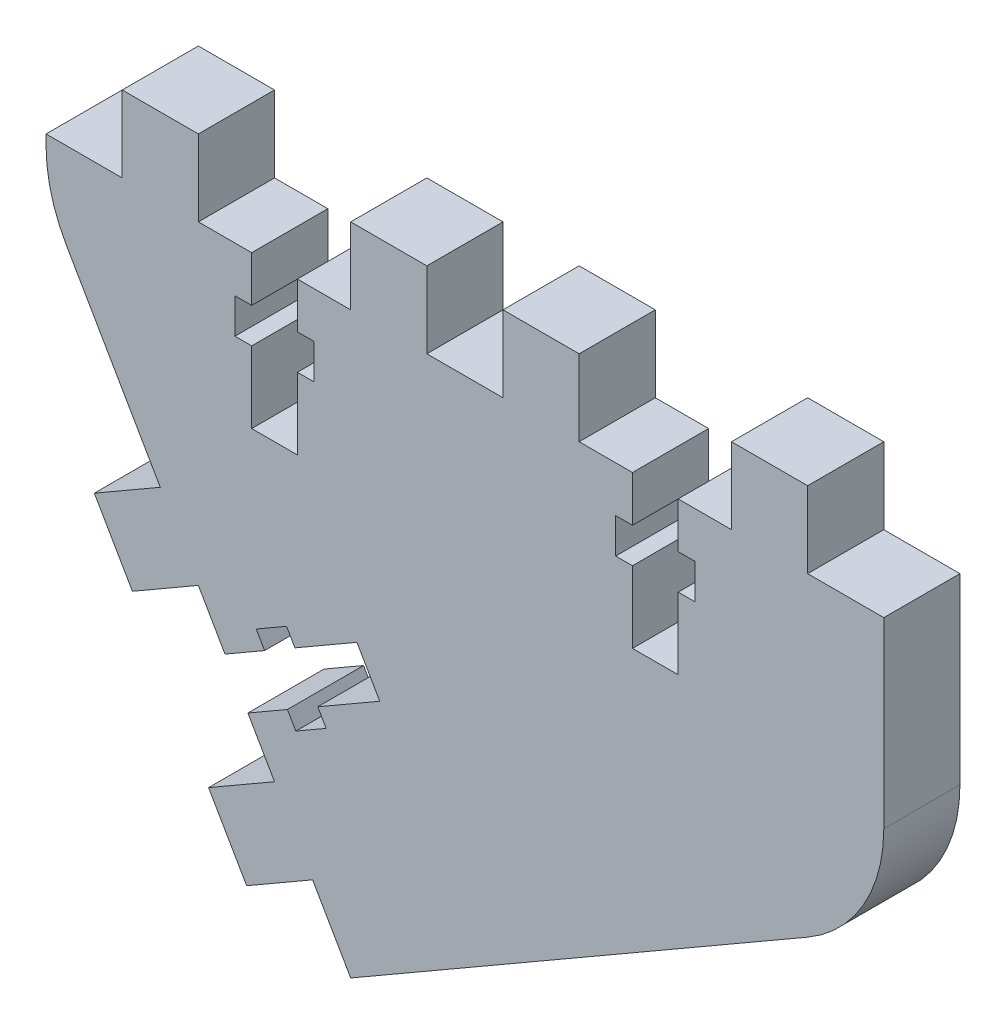
from build123d import *

# Parameters (mm, degrees)
BOSS_EXTRU_1_DEPTH = 5
CONG_1_R           = 10


with BuildPart() as part:
    # Esquisse1 → Boss.-Extru.1 (new body)
    with BuildSketch(Plane.XY):
        Polygon((-7.5, 12.990381057), (-5, 8.660254038), (-9.330127019, 6.160254038), (-6.830127019, 1.830127019), (-2.5, 4.330127019), (-0.75, 1.299038106), (1.848076211, 2.799038106), (1.298076211, 3.75166605), (3.28993464, 4.90166605), (3.83993464, 3.949038106), (7.910254038, 6.299038106), (9.410254038, 3.700961894), (5.33993464, 1.350961894), (5.88993464, 0.39833395), (3.898076211, -0.75166605), (3.348076211, 0.200961894), (0.75, -1.299038106), (2.5, -4.330127019), (-1.830127019, -6.830127019), (0.669872981, -11.160254038), (5, -8.660254038), (7.5, -12.990381057), (42.5, 7.216878365), (42.5, 25), (37.5, 25), (37.5, 30), (32.5, 30), (32.5, 25), (29, 25), (29, 22), (30.1, 22), (30.1, 19.7), (29, 19.7), (29, 15), (26, 15), (26, 19.7), (24.9, 19.7), (24.9, 22), (26, 22), (26, 25), (22.5, 25), (22.5, 30), (17.5, 30), (17.5, 25), (12.5, 25), (12.5, 30), (7.5, 30), (7.5, 25), (4, 25), (4, 22), (5.1, 22), (5.1, 19.7), (4, 19.7), (4, 15), (1, 15), (1, 19.7), (-0.1, 19.7), (-0.1, 22), (1, 22), (1, 25), (-2.5, 25), (-2.5, 30), (-7.5, 30), (-7.5, 25), (-12.5, 25), (-12.5, 21.650635095), align=None)
    extrude(amount=BOSS_EXTRU_1_DEPTH)

    # Congé1
    cong_1_edges = [part.edges().sort_by_distance(p)[0] for p in [
        (42.5, 7.216878365, 2.5),
        (-12.5, 21.650635095, 2.5),
    ]]
    fillet(cong_1_edges, radius=CONG_1_R)


solid = part.part
